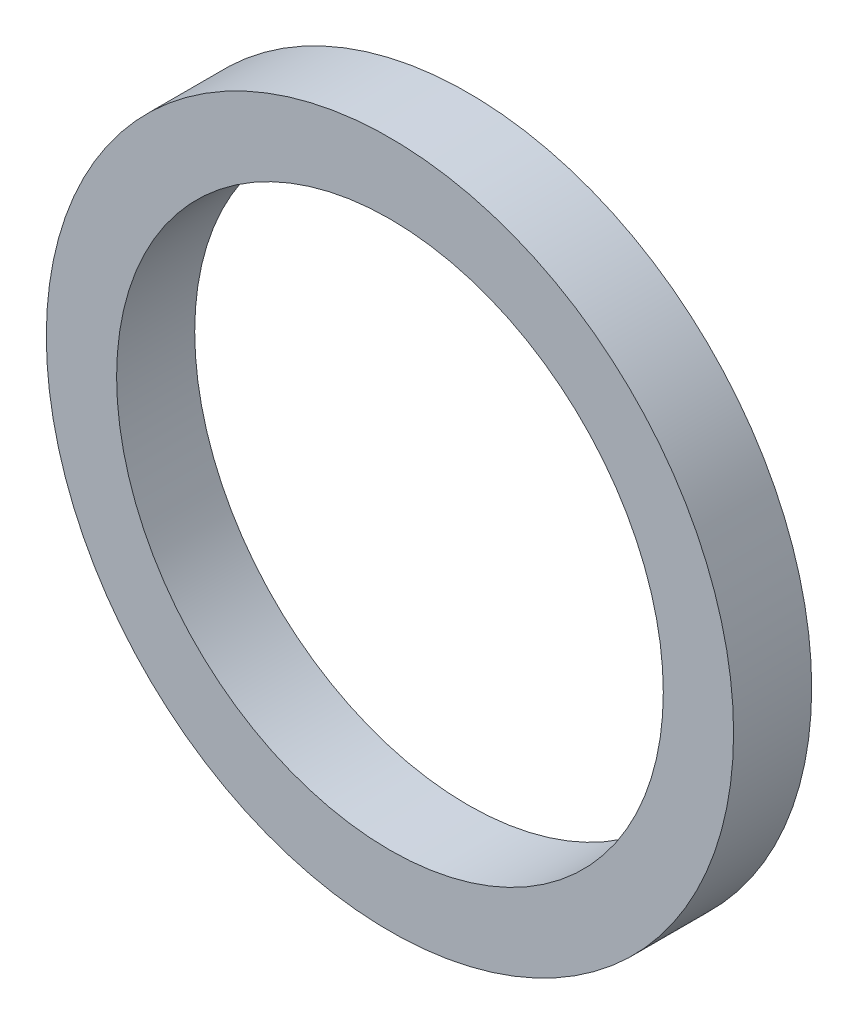
from build123d import *

# Parameters (mm, degrees)
ESBO_O1_R       = 11
ESBO_O1_R_2     = 8.75
EXTRUS_O1_DEPTH = 1.25


with BuildPart() as part:
    # Esboço1 → Extrusão1 (new, symmetric)
    with BuildSketch(Plane.XY):
        Circle(ESBO_O1_R)
        Circle(ESBO_O1_R_2, mode=Mode.SUBTRACT)
    extrude(amount=EXTRUS_O1_DEPTH, both=True)


solid = part.part
